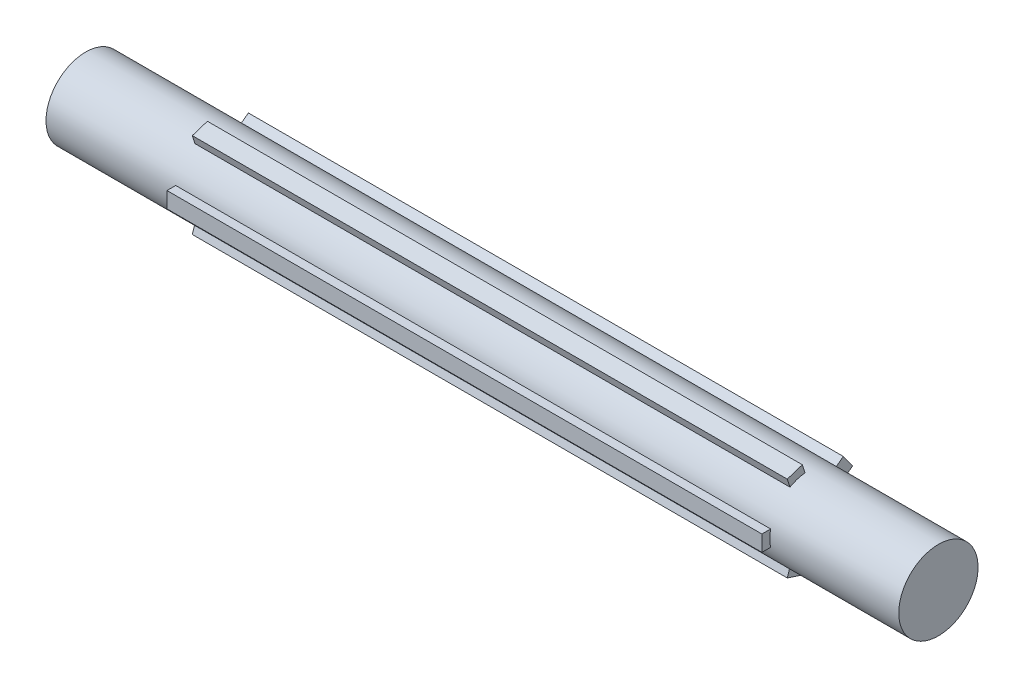
from build123d import *

# Parameters (mm, degrees)
SKETCH1_W           = 215
SKETCH1_H           = 10
SKETCH2_W           = 4
SKETCH2_H           = 4
BOSS_EXTRUDE1_DEPTH = 75
CIRPATTERN1_COUNT   = 5


with BuildPart() as part:
    # Sketch1 → Revolve1 (revolve)
    with BuildSketch(Plane.XY, mode=Mode.PRIVATE) as revolve1_sk:
        with Locations((0, 5)):
            Rectangle(SKETCH1_W, SKETCH1_H)
    revolve(revolve1_sk.sketch.rotate(Axis((0, 0, 0), (1, 0, 0)), 90), axis=Axis((0, 0, 0), (1, 0, 0)))

    # Sketch2 → Boss-Extrude1 (add, symmetric)
    with BuildSketch(Plane(origin=(0, 0, 0), x_dir=(0, 0, -1), z_dir=(1, 0, 0))):
        with Locations((-10, 0)):
            Rectangle(SKETCH2_W, SKETCH2_H)
    boss_extrude1 = extrude(amount=BOSS_EXTRUDE1_DEPTH, both=True)

    # CirPattern1: Boss-Extrude1 ×5 about axis
    cirpattern1_axis = Axis((0, 0, 0), (1, 0, 0))
    for i in range(1, CIRPATTERN1_COUNT):
        add(boss_extrude1.rotate(cirpattern1_axis, i * 360 / CIRPATTERN1_COUNT))


solid = part.part
